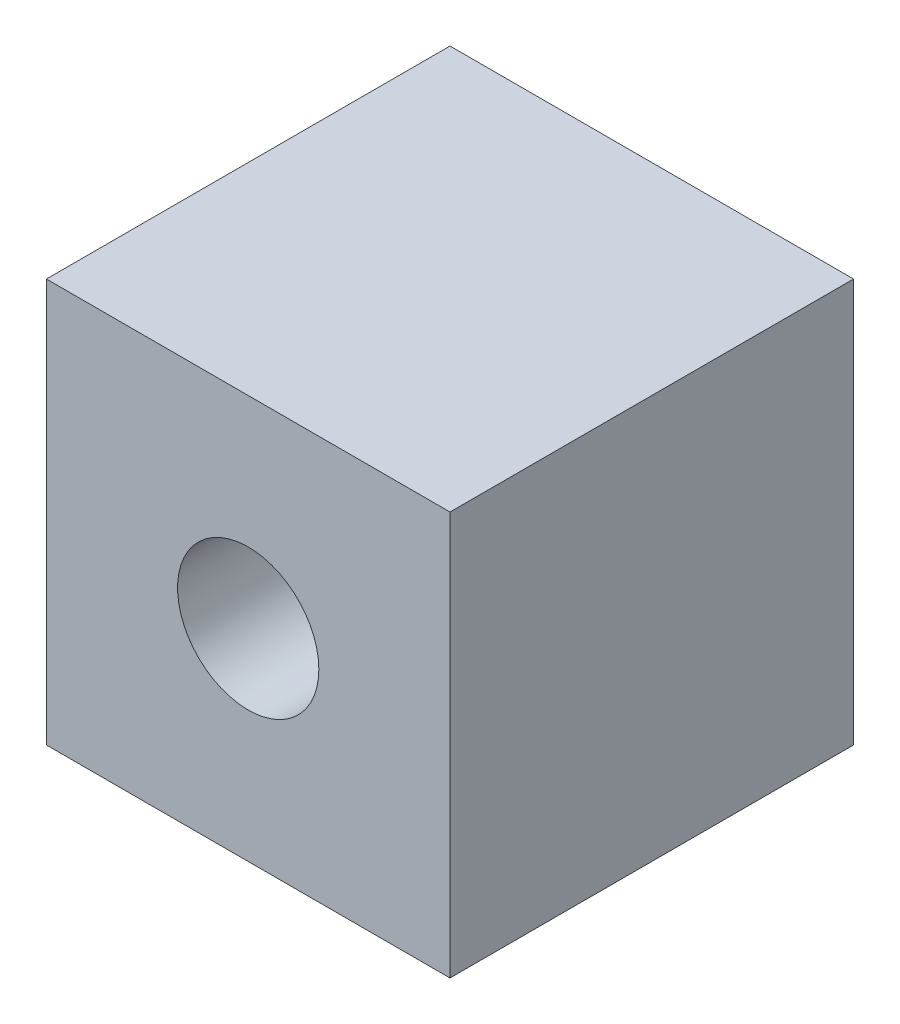
from build123d import *

# Parameters (mm, degrees)
SKETCH1_W           = 10.16
SKETCH1_H           = 10.16
SKETCH1_R           = 1.778
BOSS_EXTRUDE1_DEPTH = 10.16


with BuildPart() as part:
    # Sketch1 → Boss-Extrude1 (new body)
    with BuildSketch(Plane.XY):
        with Locations((5.08, 5.08)):
            Rectangle(SKETCH1_W, SKETCH1_H)
        with Locations((5.08, 5.08)):
            Circle(SKETCH1_R, mode=Mode.SUBTRACT)
    extrude(amount=BOSS_EXTRUDE1_DEPTH)


solid = part.part
